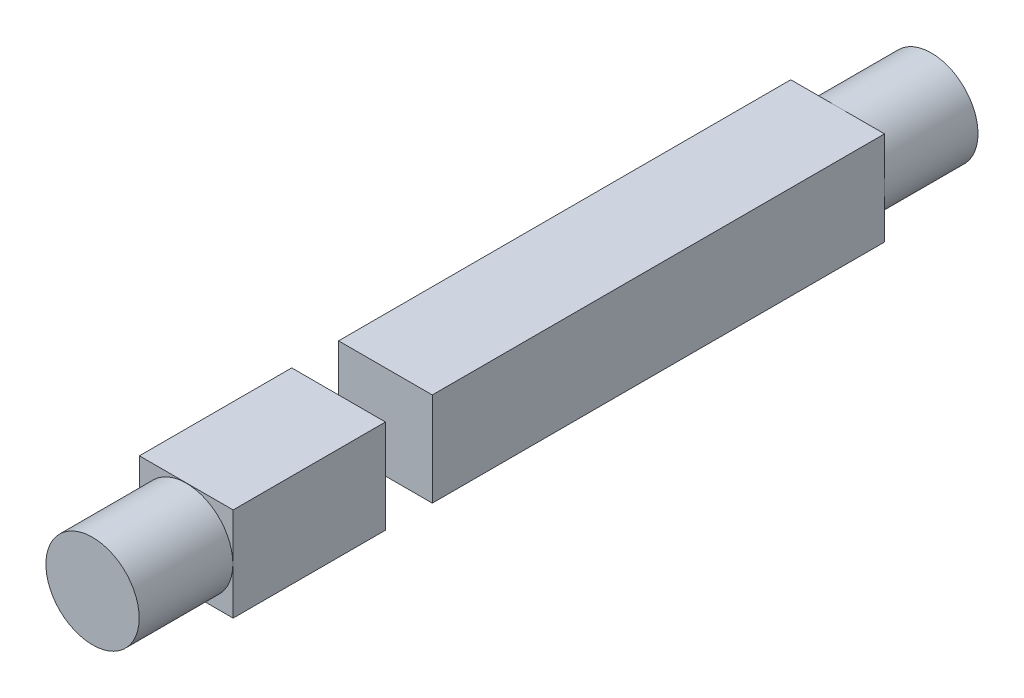
from build123d import *

# Parameters (mm, degrees)
SKETCH1_W           = 4
SKETCH1_H           = 4
BOSS_EXTRUDE1_DEPTH = 13.9
SKETCH2_R           = 1.99
BOSS_EXTRUDE2_DEPTH = 4
CUT_EXTRUDE1_REACH  = 20.45
SKETCH3_W           = 4
SKETCH3_H           = 2


with BuildPart() as part:
    # Sketch1 → Boss-Extrude1 (new, symmetric)
    with BuildSketch(Plane.XY):
        Rectangle(SKETCH1_W, SKETCH1_H)
    extrude(amount=BOSS_EXTRUDE1_DEPTH, both=True)

    # Sketch2 → Boss-Extrude2 (add)
    with BuildSketch(Plane.XY.offset(13.9)):
        Circle(SKETCH2_R)
    boss_extrude2 = extrude(amount=BOSS_EXTRUDE2_DEPTH)

    # Mirror2: Boss-Extrude2 across plane
    add(boss_extrude2.mirror(Plane.XY))

    # Sketch3 → Cut-Extrude1 (cut, up to next)
    with BuildSketch(Plane(origin=(0, 2, 0), x_dir=(1, 0, 0), z_dir=(0, 1, 0)), mode=Mode.PRIVATE) as cut_extrude1_sk1:
        with Locations((0, -6.4)):
            Rectangle(SKETCH3_W, SKETCH3_H)
    cut_extrude1_tool1 = extrude(cut_extrude1_sk1.sketch, amount=-CUT_EXTRUDE1_REACH, mode=Mode.PRIVATE) & part.part
    add(cut_extrude1_tool1.solids().sort_by_distance((0, 2, 6.4))[0], mode=Mode.SUBTRACT)


with BuildPart() as cut_extrude1_piece_1:
    # of the separate pieces the step leaves, piece 1, a body of its own (cut_extrude1_pieces)
    add(part.part.solids().sort_by_distance((2, -2, -13.9))[0])


with BuildPart() as cut_extrude1_piece_2:
    # of the separate pieces the step leaves, piece 2, a body of its own (cut_extrude1_pieces)
    add(part.part.solids().sort_by_distance((2, -2, 7.4))[0])


solid = Compound([cut_extrude1_piece_1.part, cut_extrude1_piece_2.part])
